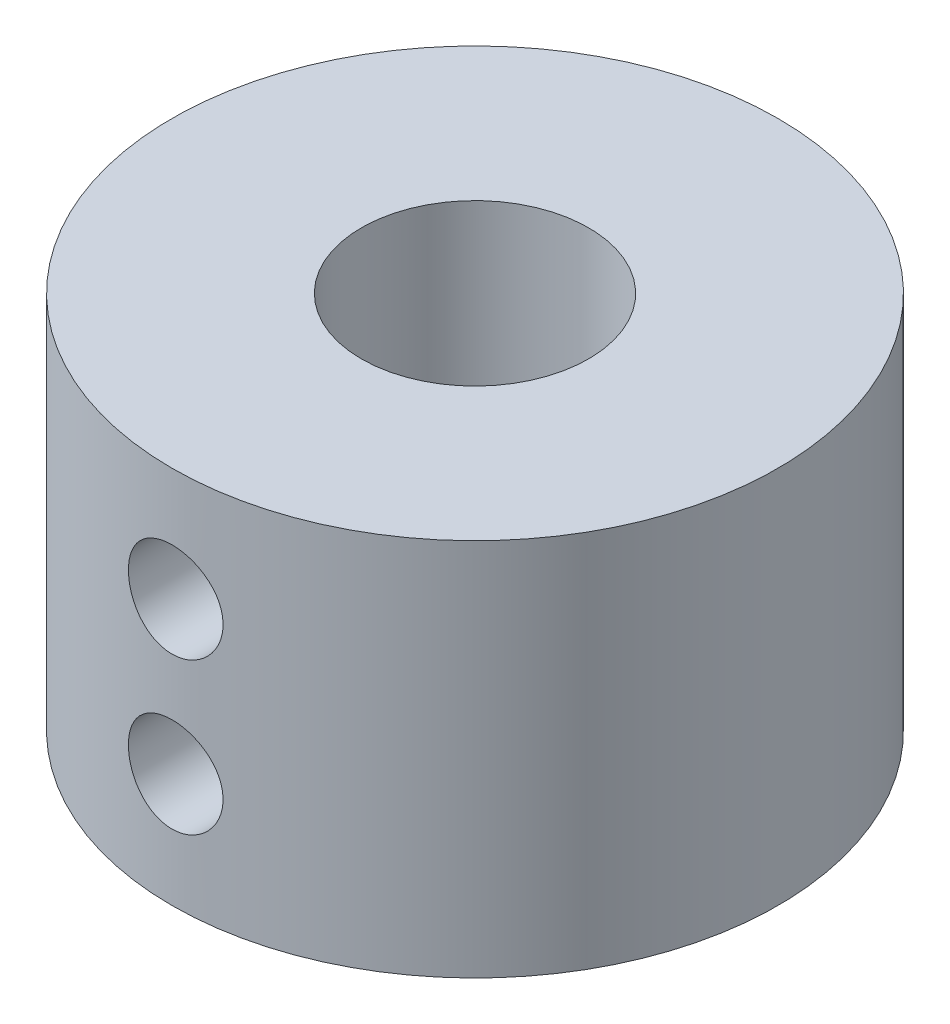
from build123d import *

# Parameters (mm, degrees)
SKETCH1_R           = 12.7
BOSS_EXTRUDE1_DEPTH = 15.875
SKETCH2_R           = 4.7625
CUT_EXTRUDE1_DEPTH  = 24.970724332
SKETCH3_R           = 1.984375
CUT_EXTRUDE2_DEPTH  = 24.970724332


with BuildPart() as part:
    # Sketch1 → Boss-Extrude1 (new body)
    with BuildSketch(Plane(origin=(0, 0, 0), x_dir=(1, 0, 0), z_dir=(0, 1, 0))):
        with Locations(Location((0, 0, 0), (0, 0, 270))):
            Circle(SKETCH1_R)
    extrude(amount=BOSS_EXTRUDE1_DEPTH)

    # Sketch2 → Cut-Extrude1 (cut, through all)
    with BuildSketch(Plane(origin=(0, 15.875, 0), x_dir=(1, 0, 0), z_dir=(0, 1, 0))):
        with Locations(Location((0, 0, 0), (0, 0, 270))):
            Circle(SKETCH2_R)
    extrude(amount=-CUT_EXTRUDE1_DEPTH, mode=Mode.SUBTRACT)

    # Sketch3 → Cut-Extrude2 (cut, through all)
    with BuildSketch(Plane.XY):
        with Locations(Location((0, 4.7625, 0), (0, 0, 90.000000002))):
            Circle(SKETCH3_R)
        with Locations(Location((0, 11.1125, 0), (0, 0, 90.000000002))):
            Circle(SKETCH3_R)
    extrude(amount=CUT_EXTRUDE2_DEPTH, mode=Mode.SUBTRACT)


solid = part.part
